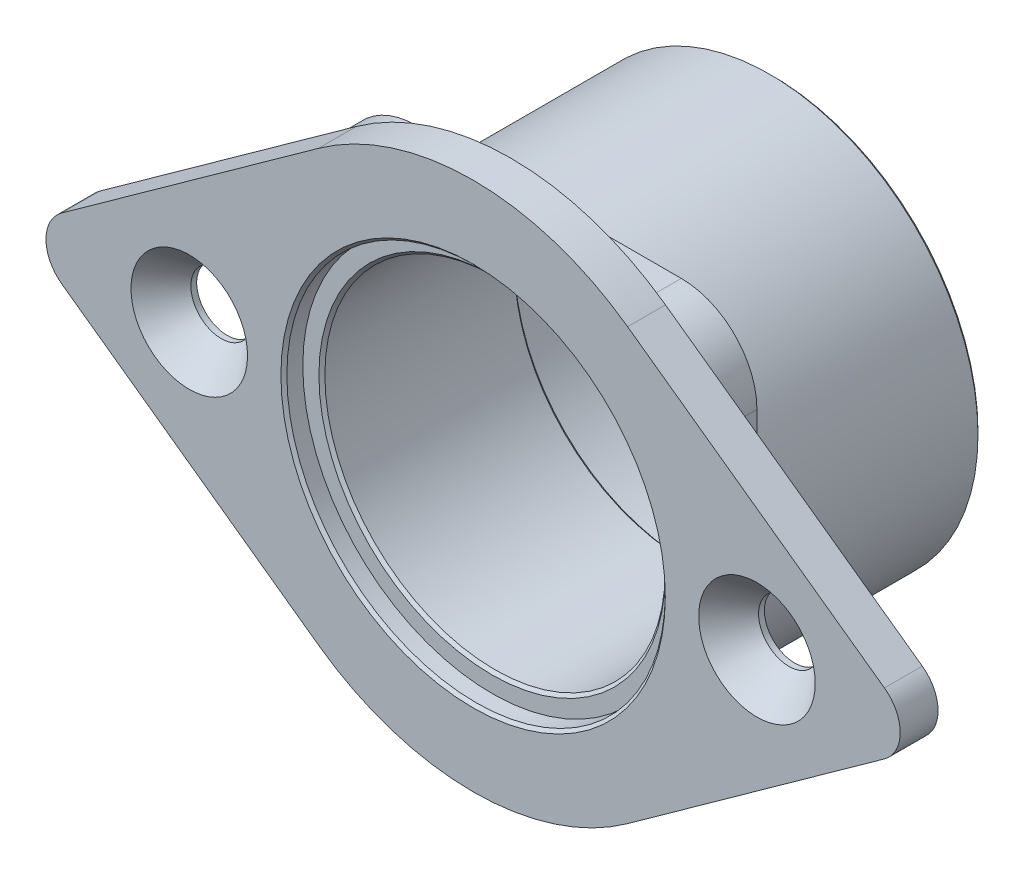
from build123d import *

# Parameters (mm, degrees)
BOSS_EXTRUDE1_DEPTH = 3.175
BOSS_EXTRUDE2_DEPTH = 3.175
SKETCH3_W           = 17.4625
SKETCH3_H           = 18.796
HOLE1_D             = 5.1054
HOLE1_CSINK_D       = 9.779
HOLE1_CSINK_ANGLE   = 82
CHAMFER1_SIZE       = 0.25
FILLET1_R           = 22.225


with BuildPart() as part:
    # Sketch1 → Boss-Extrude1 (new body)
    with BuildSketch(Plane.XY.offset(1.5875)):
        with BuildLine():
            Line((-34.50922619, -2.578839337), (0, -27.36284265))
            Line((0, -27.36284265), (34.50922619, -2.578839337))
            ThreePointArc((34.50922619, -2.578839337), (35.832142857, 0), (34.50922619, 2.578839337))
            Line((34.50922619, 2.578839337), (0, 27.36284265))
            Line((0, 27.36284265), (-34.50922619, 2.578839337))
            ThreePointArc((-34.50922619, 2.578839337), (-35.832142857, 0), (-34.50922619, -2.578839337))
        make_face()
    extrude(amount=-BOSS_EXTRUDE1_DEPTH)

    # Sketch2 → Boss-Extrude2 (add)
    with BuildSketch(Plane(origin=(0, 0, -1.5875), x_dir=(-1, 0, 0), z_dir=(0, 0, -1))):
        with BuildLine():
            Line((11.1125, -17.4625), (-11.1125, -17.4625))
            ThreePointArc((-11.1125, -17.4625), (-15.602628061, -15.602628061), (-17.4625, -11.1125))
            Line((-17.4625, -11.1125), (-17.4625, 11.1125))
            ThreePointArc((-17.4625, 11.1125), (-15.602628061, 15.602628061), (-11.1125, 17.4625))
            Line((-11.1125, 17.4625), (11.1125, 17.4625))
            ThreePointArc((11.1125, 17.4625), (15.602628061, 15.602628061), (17.4625, 11.1125))
            Line((17.4625, 11.1125), (17.4625, -11.1125))
            ThreePointArc((17.4625, -11.1125), (15.602628061, -15.602628061), (11.1125, -17.4625))
        make_face()
    extrude(amount=BOSS_EXTRUDE2_DEPTH)

    # Sketch3 → Revolve1 (revolve)
    with BuildSketch(Plane(origin=(0, 0, 0), x_dir=(1, 0, 0), z_dir=(0, 1, 0))):
        with Locations((8.73125, 14.1605)):
            Rectangle(SKETCH3_W, SKETCH3_H)
    revolve(axis=Axis((0, 0, -23.5585), (0, 0, 1)))

    # Sketch4 → Cut-Revolve1 (revolve, cut)
    with BuildSketch(Plane.XZ, mode=Mode.PRIVATE) as cut_revolve1_sk:
        Polygon((15.875, 1.5875), (0, 1.5875), (0, -23.5585), (15.86865, -23.5585), (15.86865, -16.41475), (14.2748, -16.41475), (14.2748, 0), (15.875, 0), align=None)
    revolve(cut_revolve1_sk.sketch.rotate(Axis((0, 0, 1.5875), (0, 0, -1)), 180), axis=Axis((0, 0, 1.5875), (0, 0, -1)), mode=Mode.SUBTRACT)

    # Hole1 (through all)
    with Locations(Plane.XY.offset(1.5875)):
        with Locations((-23.8125, 0), (23.8125, 0)):
            CounterSinkHole(HOLE1_D / 2, HOLE1_CSINK_D / 2, counter_sink_angle=HOLE1_CSINK_ANGLE)

    # Chamfer1
    chamfer1_edges = [part.edges().sort_by_distance(p)[0] for p in [
        (-17.4625, 0, -23.5585),
        (15.875, 0, 1.5875),
        (15.86865, 0, -23.5585),
        (14.2748, 0, -16.41475),
        (14.2748, 0, 0),
    ]]
    chamfer(chamfer1_edges, length=CHAMFER1_SIZE)

    # Fillet1
    fillet1_edges = [part.edges().sort_by_distance(p)[0] for p in [
        (0, 27.36284265, 0),
        (0, -27.36284265, 0),
    ]]
    fillet(fillet1_edges, radius=FILLET1_R)


solid = part.part
